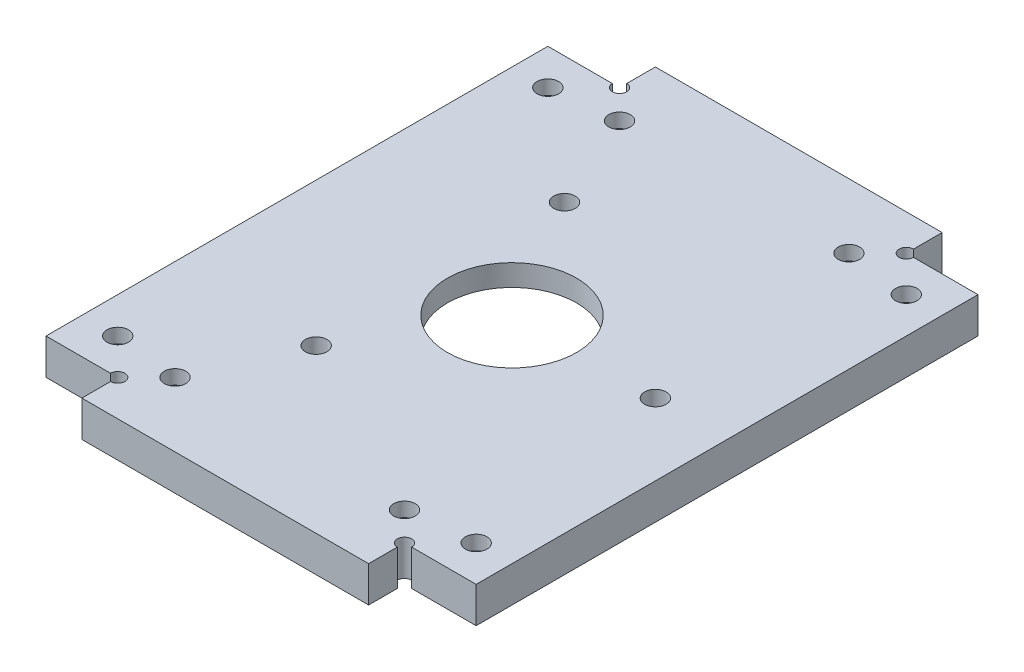
from build123d import *

# Parameters (mm, degrees)
SKETCH_1_W          = 60
SKETCH_1_H          = 80
EXTRUDE_1_DEPTH     = 5
SKETCH_2_R          = 1.5
SKETCH_2_R_2        = 9
CUT_EXTRUDE_1_DEPTH = 51.249378106
SKETCH_3_R          = 1.5
CUT_EXTRUDE_2_DEPTH = 51.249378106
SKETCH_4_R          = 3
CUT_EXTRUDE_3_DEPTH = 3
SKETCH_5_OUTSIDE_W  = 82.024
SKETCH_5_OUTSIDE_H  = 102.024
SKETCH_5_OUTSIDE_R  = 1.5
CUT_EXTRUDE_4_DEPTH = 51.249378106
SKETCH_6_R          = 12
CUT_EXTRUDE_5_DEPTH = 2


with BuildPart() as part:
    # 草图1 → 凸台-拉伸1 (new body)
    with BuildSketch(Plane(origin=(0, 0, 0), x_dir=(1, 0, 0), z_dir=(0, 1, 0))):
        Rectangle(SKETCH_1_W, SKETCH_1_H)
    extrude(amount=EXTRUDE_1_DEPTH)

    # 草图2 → 切除-拉伸1 (cut, through all)
    with BuildSketch(Plane(origin=(0, 5, 0), x_dir=(1, 0, 0), z_dir=(0, 1, 0))):
        with Locations(Location((20, 0, 0), (0, 0, 270))):
            Circle(SKETCH_2_R)
        with Locations(Location((-10, -17.320508076, 0), (0, 0, 270))):
            Circle(SKETCH_2_R)
        with Locations(Location((-10, 17.320508076, 0), (0, 0, 270))):
            Circle(SKETCH_2_R)
        with Locations(Location((0, 0, 0), (0, 0, 270))):
            Circle(SKETCH_2_R_2)
    extrude(amount=-CUT_EXTRUDE_1_DEPTH, mode=Mode.SUBTRACT)

    # 草图3 → 切除-拉伸2 (cut, through all)
    with BuildSketch(Plane(origin=(0, 5, 0), x_dir=(1, 0, 0), z_dir=(0, 1, 0))):
        with Locations(Location((-25, 30, 0), (0, 0, 270))):
            Circle(SKETCH_3_R)
        with Locations(Location((25, 30, 0), (0, 0, 270))):
            Circle(SKETCH_3_R)
        with Locations(Location((-25, -30, 0), (0, 0, 270))):
            Circle(SKETCH_3_R)
        with Locations(Location((25, -30, 0), (0, 0, 270))):
            Circle(SKETCH_3_R)
        with Locations(Location((-16, -31, 0), (0, 0, 270))):
            Circle(SKETCH_3_R)
        with Locations(Location((16, -31, 0), (0, 0, 270))):
            Circle(SKETCH_3_R)
        with Locations(Location((16, 31, 0), (0, 0, 90))):
            Circle(SKETCH_3_R)
        with Locations(Location((-16, 31, 0), (0, 0, 90))):
            Circle(SKETCH_3_R)
    extrude(amount=-CUT_EXTRUDE_2_DEPTH, mode=Mode.SUBTRACT)

    # 草图4 → 切除-拉伸3 (cut)
    with BuildSketch(Plane.XZ):
        with Locations(Location((-25, 30, 0), (0, 0, 270))):
            Circle(SKETCH_4_R)
        with Locations(Location((25, 30, 0), (0, 0, 270))):
            Circle(SKETCH_4_R)
        with Locations(Location((25, -30, 0), (0, 0, 270))):
            Circle(SKETCH_4_R)
        with Locations(Location((-25, -30, 0), (0, 0, 270))):
            Circle(SKETCH_4_R)
        with Locations(Location((-16, 31, 0), (0, 0, 270))):
            Circle(SKETCH_4_R)
        with Locations(Location((16, 31, 0), (0, 0, 270))):
            Circle(SKETCH_4_R)
        with Locations(Location((-16, -31, 0), (0, 0, 270))):
            Circle(SKETCH_4_R)
        with Locations(Location((16, -31, 0), (0, 0, 270))):
            Circle(SKETCH_4_R)
    extrude(amount=-CUT_EXTRUDE_3_DEPTH, mode=Mode.SUBTRACT)

    # 草图5 outside → 切除-拉伸4 (cut, through all)
    # profile 1 of 8: a face of its own
    with BuildSketch(Plane(origin=(0, 5, 0), x_dir=(1, 0, 0), z_dir=(0, 1, 0))):
        Rectangle(SKETCH_5_OUTSIDE_W, SKETCH_5_OUTSIDE_H)
        with BuildLine():
            Line((-20, -36), (-20, -40))
            Line((-20, -40), (20, -40))
            Line((20, -40), (20, -36))
            ThreePointArc((20, -36), (19.292893219, -34.292893219), (21, -35))
            Line((21, -35), (30, -35))
            Line((30, -35), (30, 35))
            Line((30, 35), (21, 35))
            ThreePointArc((21, 35), (19.292893219, 34.292893219), (20, 36))
            Line((20, 36), (20, 40))
            Line((20, 40), (-20, 40))
            Line((-20, 40), (-20, 36))
            ThreePointArc((-20, 36), (-19.292893219, 35.707106781), (-19, 35))
            ThreePointArc((-19, 35), (-20, 34), (-21, 35))
            Line((-21, 35), (-30, 35))
            Line((-30, 35), (-30, -35))
            Line((-30, -35), (-21, -35))
            ThreePointArc((-21, -35), (-20, -34), (-19, -35))
            ThreePointArc((-19, -35), (-19.292893219, -35.707106781), (-20, -36))
        make_face(mode=Mode.SUBTRACT)
    # profile 2 of 8: a face of its own
    with BuildSketch(Plane(origin=(0, 5, 0), x_dir=(1, 0, 0), z_dir=(0, 1, 0))):
        with Locations(Location((-25, -30, 0), (0, 0, 270))):
            Circle(SKETCH_5_OUTSIDE_R)
    # profile 3 of 8: a face of its own
    with BuildSketch(Plane(origin=(0, 5, 0), x_dir=(1, 0, 0), z_dir=(0, 1, 0))):
        with Locations(Location((-10, -17.320508076, 0), (0, 0, 270))):
            Circle(SKETCH_5_OUTSIDE_R)
    # profile 4 of 8: a face of its own
    with BuildSketch(Plane(origin=(0, 5, 0), x_dir=(1, 0, 0), z_dir=(0, 1, 0))):
        with Locations(Location((25, -30, 0), (0, 0, 270))):
            Circle(SKETCH_5_OUTSIDE_R)
    # profile 5 of 8: a face of its own
    with BuildSketch(Plane(origin=(0, 5, 0), x_dir=(1, 0, 0), z_dir=(0, 1, 0))):
        with Locations(Location((20, 0, 0), (0, 0, 270))):
            Circle(SKETCH_5_OUTSIDE_R)
    # profile 6 of 8: a face of its own
    with BuildSketch(Plane(origin=(0, 5, 0), x_dir=(1, 0, 0), z_dir=(0, 1, 0))):
        with Locations(Location((-10, 17.320508076, 0), (0, 0, 270))):
            Circle(SKETCH_5_OUTSIDE_R)
    # profile 7 of 8: a face of its own
    with BuildSketch(Plane(origin=(0, 5, 0), x_dir=(1, 0, 0), z_dir=(0, 1, 0))):
        with Locations(Location((-25, 30, 0), (0, 0, 270))):
            Circle(SKETCH_5_OUTSIDE_R)
    # profile 8 of 8: a face of its own
    with BuildSketch(Plane(origin=(0, 5, 0), x_dir=(1, 0, 0), z_dir=(0, 1, 0))):
        with Locations(Location((25, 30, 0), (0, 0, 270))):
            Circle(SKETCH_5_OUTSIDE_R)
    extrude(amount=-CUT_EXTRUDE_4_DEPTH, mode=Mode.SUBTRACT)

    # 草图6 → 切除-拉伸5 (cut)
    with BuildSketch(Plane.XZ):
        with Locations(Location((0, 0, 0), (0, 0, 270))):
            Circle(SKETCH_6_R)
    extrude(amount=-CUT_EXTRUDE_5_DEPTH, mode=Mode.SUBTRACT)


solid = part.part
